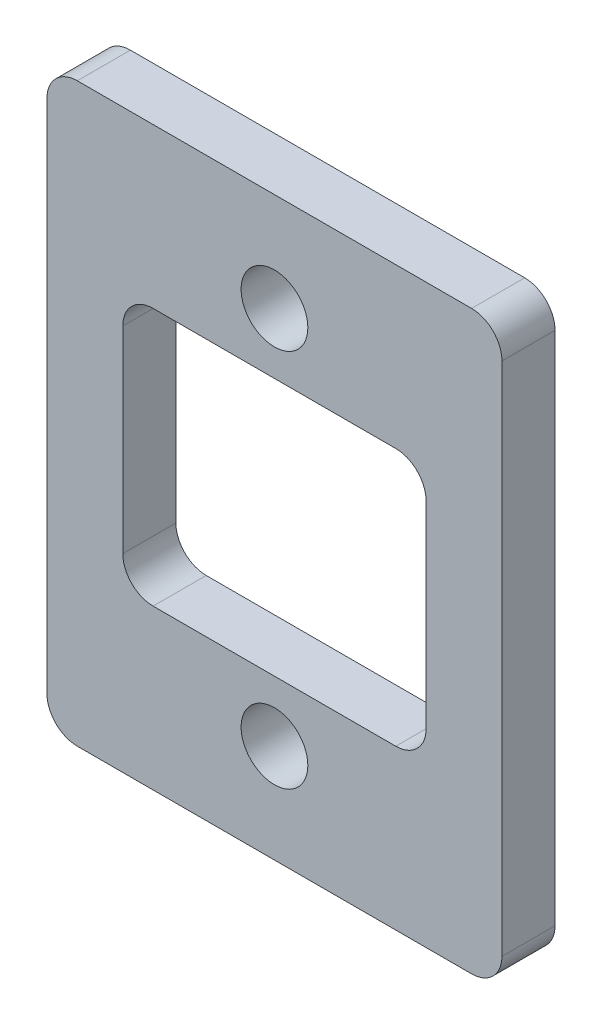
from build123d import *

# Parameters (mm, degrees)
SKETCH_1_W          = 30
SKETCH_1_H          = 38
SKETCH_1_R          = 2.2
EXTRUDE_1_DEPTH     = 3.5
SKETCH_2_W          = 20
SKETCH_2_H          = 17
CUT_EXTRUDE_1_DEPTH = 10
FILLET_1_R          = 2


with BuildPart() as part:
    # 草图1 → 凸台-拉伸1 (new body)
    with BuildSketch(Plane.XY):
        Rectangle(SKETCH_1_W, SKETCH_1_H)
        with Locations((0, 12.5)):
            Circle(SKETCH_1_R, mode=Mode.SUBTRACT)
        with Locations((0, -12.5)):
            Circle(SKETCH_1_R, mode=Mode.SUBTRACT)
    extrude(amount=EXTRUDE_1_DEPTH)

    # 草图2 → 切除-拉伸1 (cut)
    with BuildSketch(Plane.XY.offset(3.5)):
        Rectangle(SKETCH_2_W, SKETCH_2_H)
    extrude(amount=-CUT_EXTRUDE_1_DEPTH, mode=Mode.SUBTRACT)

    # 圆角1
    fillet_1_edges = [part.edges().sort_by_distance(p)[0] for p in [
        (10, 8.5, 1.75),
        (10, -8.5, 1.75),
        (-10, -8.5, 1.75),
        (-10, 8.5, 1.75),
        (15, -19, 1.75),
        (-15, -19, 1.75),
        (-15, 19, 1.75),
        (15, 19, 1.75),
    ]]
    fillet(fillet_1_edges, radius=FILLET_1_R)


solid = part.part
